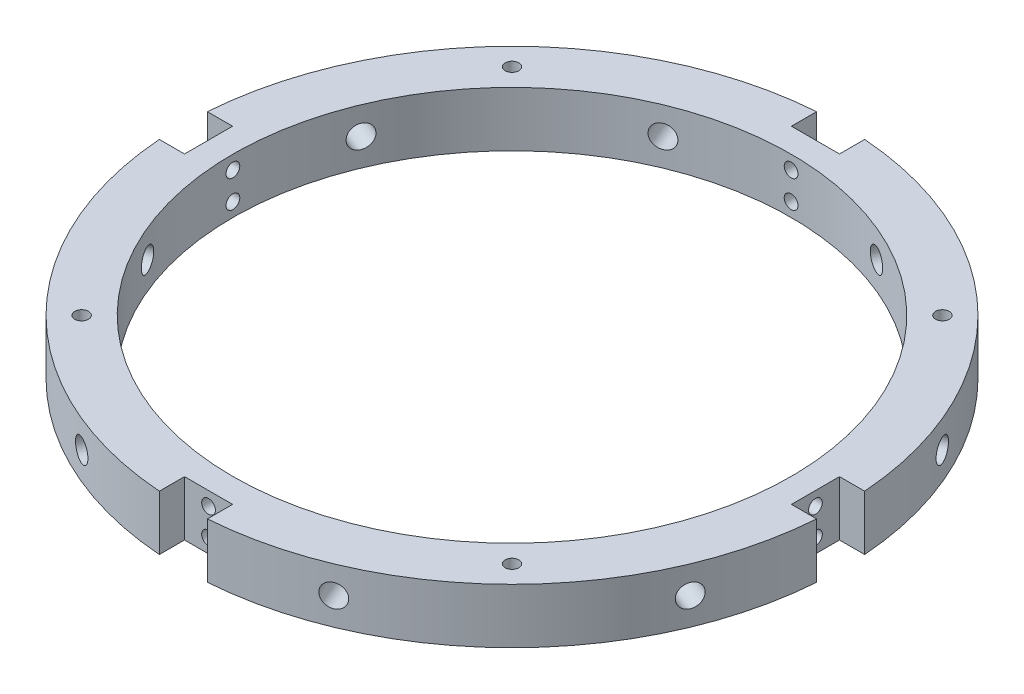
from build123d import *

# Parameters (mm, degrees)
BOSS_EXTRUDE1_DEPTH      = 6
BOSS_EXTRUDE1_DEPTH_BACK = 6
SKETCH1_R                = 72
SKETCH1_R_2              = 61
SKETCH5_R                = 1.5
CUT_EXTRUDE3_DEPTH       = 103.528044944
SKETCH6_W                = 10.5
SKETCH6_H                = 11
SKETCH6_W_2              = 11
SKETCH6_H_2              = 10.5
CUT_EXTRUDE4_DEPTH       = 103.528044944
SKETCH12_R               = 1.5
CUT_EXTRUDE8_DEPTH       = 156.783998054
SKETCH15_R               = 2.5
CUT_EXTRUDE10_DEPTH      = 228.56691714
SKETCH16_R               = 2.5
CUT_EXTRUDE11_DEPTH      = 228.566917278
SKETCH17_R               = 2.5
CUT_EXTRUDE12_DEPTH      = 228.566917278
SKETCH18_R               = 2.5
CUT_EXTRUDE13_DEPTH      = 228.566917278
SKETCH19_R               = 1.5
CUT_EXTRUDE14_DEPTH      = 156.783998192


with BuildPart() as part:
    # Sketch1 → Boss-Extrude1 (new, two sides: drawn at the far end of the back side and taken through both)
    with BuildSketch(Plane(origin=(0, 0, 0), x_dir=(1, 0, 0), z_dir=(0, 1, 0)).offset(-BOSS_EXTRUDE1_DEPTH_BACK)):
        Circle(SKETCH1_R)
        Circle(SKETCH1_R_2, mode=Mode.SUBTRACT)
    extrude(amount=BOSS_EXTRUDE1_DEPTH + BOSS_EXTRUDE1_DEPTH_BACK)

    # Sketch5 → Cut-Extrude3 (cut, through all)
    with BuildSketch(Plane(origin=(0, 6, 0), x_dir=(1, 0, 0), z_dir=(0, 1, 0))):
        with Locations((47.022600949, 47.022600949)):
            Circle(SKETCH5_R)
        with Locations((47.022600949, -47.022600949)):
            Circle(SKETCH5_R)
        with Locations((-47.022600949, -47.022600949)):
            Circle(SKETCH5_R)
        with Locations((-47.022600949, 47.022600949)):
            Circle(SKETCH5_R)
    extrude(amount=-CUT_EXTRUDE3_DEPTH, mode=Mode.SUBTRACT)

    # Sketch6 → Cut-Extrude4 (cut, through all)
    with BuildSketch(Plane(origin=(0, 6, 0), x_dir=(1, 0, 0), z_dir=(0, 1, 0))):
        with Locations((0, -71.808338652)):
            Rectangle(SKETCH6_W, SKETCH6_H)
        with Locations((-71.808338652, 0)):
            Rectangle(SKETCH6_W_2, SKETCH6_H_2)
        with Locations((71.808338652, 0)):
            Rectangle(SKETCH6_W_2, SKETCH6_H_2)
        with Locations((0, 71.808338652)):
            Rectangle(SKETCH6_W, SKETCH6_H)
    extrude(amount=-CUT_EXTRUDE4_DEPTH, mode=Mode.SUBTRACT)

    # Sketch12 → Cut-Extrude8 (cut, through all)
    with BuildSketch(Plane.XY.offset(66.308338652)):
        with Locations((0, 3)):
            Circle(SKETCH12_R)
        with Locations((0, -3)):
            Circle(SKETCH12_R)
    extrude(amount=-CUT_EXTRUDE8_DEPTH, mode=Mode.SUBTRACT)

    # Sketch15 → Cut-Extrude10 (cut, through all)
    with BuildSketch(Plane(origin=(-49.779681973, 6, -120.17878335), x_dir=(-0.9238795325112865, 0, 0.3826834323650906), z_dir=(-0.3826834323650906, 0, -0.9238795325112865))):
        with Locations((0, -6)):
            Circle(SKETCH15_R)
    extrude(amount=-CUT_EXTRUDE10_DEPTH, mode=Mode.SUBTRACT)

    # Sketch16 → Cut-Extrude11 (cut, through all)
    with BuildSketch(Plane(origin=(-120.17878335, 6, -49.779681973), x_dir=(-0.3826834323650807, 0, 0.9238795325112905), z_dir=(-0.9238795325112905, 0, -0.3826834323650807))):
        with Locations((0, -6)):
            Circle(SKETCH16_R)
    extrude(amount=-CUT_EXTRUDE11_DEPTH, mode=Mode.SUBTRACT)

    # Sketch17 → Cut-Extrude12 (cut, through all)
    with BuildSketch(Plane(origin=(-120.17878335, 6, 49.779681973), x_dir=(0.3826834323650807, 0, 0.9238795325112905), z_dir=(-0.9238795325112905, 0, 0.3826834323650807))):
        with Locations((0, -6)):
            Circle(SKETCH17_R)
    extrude(amount=-CUT_EXTRUDE12_DEPTH, mode=Mode.SUBTRACT)

    # Sketch18 → Cut-Extrude13 (cut, through all)
    with BuildSketch(Plane(origin=(-49.779681973, 6, 120.17878335), x_dir=(0.9238795325112865, 0, 0.3826834323650906), z_dir=(-0.3826834323650906, 0, 0.9238795325112865))):
        with Locations((0, -6)):
            Circle(SKETCH18_R)
    extrude(amount=-CUT_EXTRUDE13_DEPTH, mode=Mode.SUBTRACT)

    # Sketch19 → Cut-Extrude14 (cut, through all)
    with BuildSketch(Plane(origin=(66.308338652, 0, 0), x_dir=(0, 0, -1), z_dir=(1, 0, 0))):
        with Locations((0, 3)):
            Circle(SKETCH19_R)
        with Locations((0, -3)):
            Circle(SKETCH19_R)
    extrude(amount=-CUT_EXTRUDE14_DEPTH, mode=Mode.SUBTRACT)


solid = part.part
